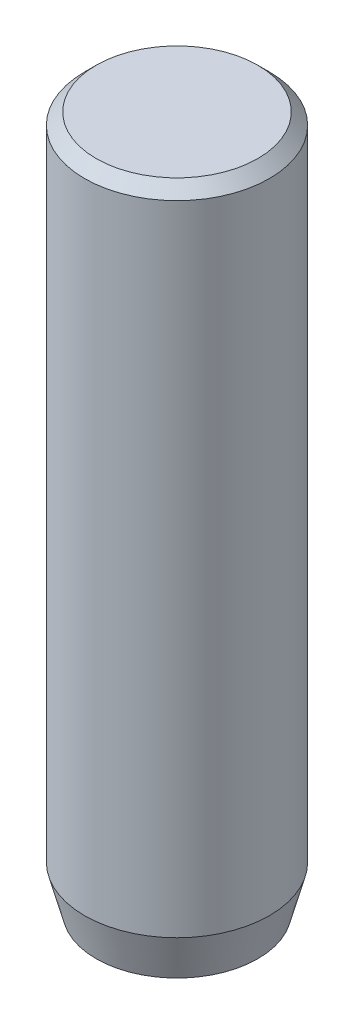
from build123d import *

# Parameters (mm, degrees)
SKETCH_1_R      = 4
EXTRUDE_1_DEPTH = 15
CHAMFER_1_SIZE  = 0.5
CHAMFER_2_SIZE  = 0.5
CHAMFER_2_SIZE2 = 1.866025404


with BuildPart() as part:
    # 草圖1 → 伸長1 (new, symmetric)
    with BuildSketch(Plane(origin=(0, 0, 0), x_dir=(1, 0, 0), z_dir=(0, 1, 0))):
        with Locations(Location((0, 0, 0), (0, 0, 270))):
            Circle(SKETCH_1_R)
    extrude(amount=EXTRUDE_1_DEPTH, both=True)

    # 導角1
    chamfer_1_edges = [part.edges().sort_by_distance(p)[0] for p in [
        (0, 15, -4),
    ]]
    chamfer(chamfer_1_edges, length=CHAMFER_1_SIZE)

    # 導角2
    chamfer_2_edges = [part.edges().sort_by_distance(p)[0] for p in [
        (0, -15, -4),
    ]]
    chamfer_2_side = [part.faces().sort_by_distance(p)[0] for p in [
        (0, -15, 0),
    ]]
    chamfer(chamfer_2_edges, length=CHAMFER_2_SIZE, length2=CHAMFER_2_SIZE2, reference=chamfer_2_side[0])


solid = part.part
